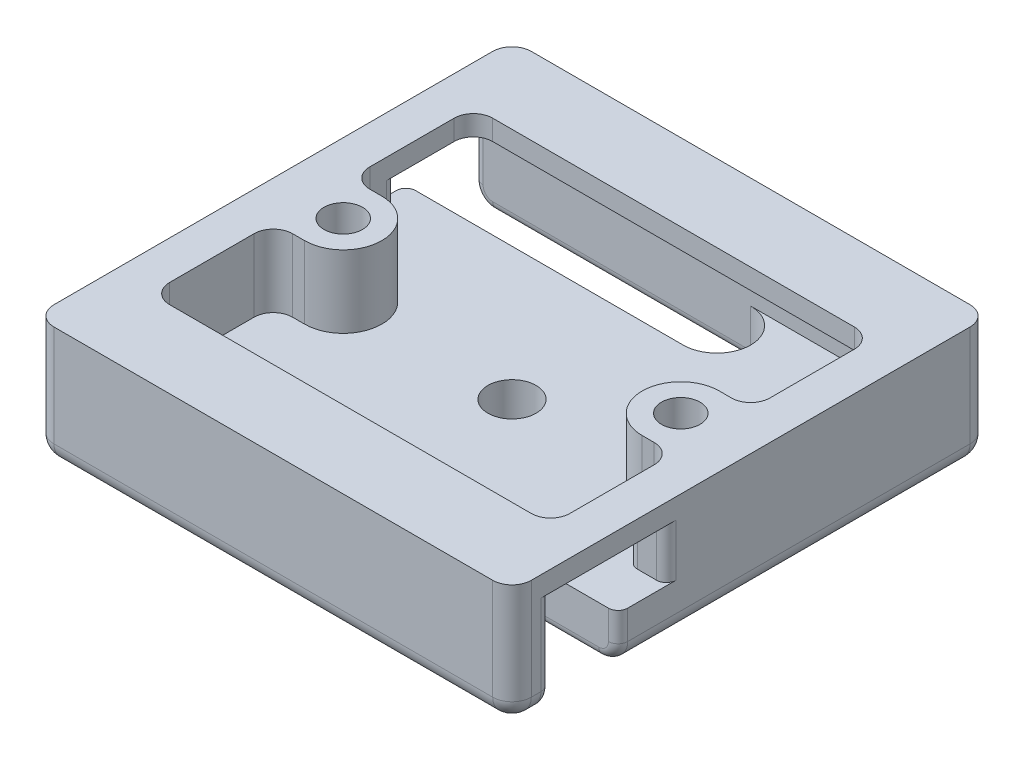
from build123d import *

# Parameters (mm, degrees)
CROQUIS1_R                   = 2.5
SALIENTE_EXTRUIR1_DEPTH      = 5
SALIENTE_EXTRUIR2_DEPTH      = 5.5
SALIENTE_EXTRUIR5_DEPTH      = 2
SALIENTE_EXTRUIR5_DEPTH_BACK = 0.1
CROQUIS2_W                   = 41.5
CROQUIS2_H                   = 8
CROQUIS2_H_2                 = 4
CROQUIS2_W_2                 = 4
CROQUIS3_R                   = 2
SALIENTE_EXTRUIR6_DEPTH      = 7.5
CORTAR_EXTRUIR1_REACH        = 39.167
CROQUIS3_3_R                 = 2
CORTAR_EXTRUIR2_START        = -3
CROQUIS4_R                   = 3.5
CROQUIS4_R_2                 = 2
CORTAR_EXTRUIR2_DEPTH        = 3
REDONDEO1_R                  = 2
REDONDEO4_R                  = 2
REDONDEO3_R                  = 1


with BuildPart() as part:
    # Croquis1 → Saliente-Extruir1 (new body)
    with BuildSketch(Plane(origin=(0, 0, 0), x_dir=(1, 0, 0), z_dir=(0, 1, 0))):
        with BuildLine():
            Line((-24.75, -24.75), (24.75, -24.75))
            Line((24.75, -24.75), (24.75, -20.75))
            Line((24.75, -20.75), (-4, -20.75))
            ThreePointArc((-4, -20.75), (-7.5, -17.25), (-4, -13.75))
            Line((-4, -13.75), (24.75, -13.75))
            Line((24.75, -13.75), (24.75, 24.75))
            Line((24.75, 24.75), (-24.75, 24.75))
            Line((-24.75, 24.75), (-24.75, 20.75))
            Line((-24.75, 20.75), (4, 20.75))
            ThreePointArc((4, 20.75), (7.5, 17.25), (4, 13.75))
            Line((4, 13.75), (-24.75, 13.75))
            Line((-24.75, 13.75), (-24.75, -24.75))
        make_face()
        with Locations(Location((0, 0, 0), (0, 0, 270))):
            Circle(CROQUIS1_R, mode=Mode.SUBTRACT)
    extrude(amount=-SALIENTE_EXTRUIR1_DEPTH)

    # Croquis1<3> → Saliente-Extruir2 (add)
    with BuildSketch(Plane(origin=(0, 0, 0), x_dir=(1, 0, 0), z_dir=(0, 1, 0))):
        Polygon((-24.75, 8.75), (-24.75, -24.75), (24.75, -24.75), (24.75, -20.75), (-4, -20.75), (-20.75, -20.75), (-20.75, 8.75), align=None)
        Polygon((-24.75, 24.75), (-24.75, 20.75), (4, 20.75), (20.75, 20.75), (20.75, -8.75), (24.75, -8.75), (24.75, 24.75), align=None)
    extrude(amount=SALIENTE_EXTRUIR2_DEPTH)

    # Croquis2 → Saliente-Extruir5 (add, two sides: drawn at the far end of the back side and taken through both)
    with BuildSketch(Plane(origin=(0, 5.5, 0), x_dir=(1, 0, 0), z_dir=(0, 1, 0)).offset(-SALIENTE_EXTRUIR5_DEPTH_BACK)):
        with Locations((0, 20.75)):
            Rectangle(CROQUIS2_W, CROQUIS2_H)
        Polygon((-20.75, 24.75), (-24.75, 24.75), (-24.75, 8.75), (-20.75, 8.75), (-20.75, 16.75), align=None)
        with Locations((0, -18.75)):
            Rectangle(CROQUIS2_W, CROQUIS2_H_2)
        with Locations((0, -22.75)):
            Rectangle(CROQUIS2_W, CROQUIS2_H_2)
        Polygon((-20.75, 8.75), (-24.75, 8.75), (-24.75, -24.75), (-20.75, -24.75), (-20.75, -20.75), (-20.75, -16.75), align=None)
        Polygon((24.75, 24.75), (20.75, 24.75), (20.75, 16.75), (20.75, -16.75), (20.75, -20.75), (24.75, -20.75), align=None)
        with Locations((22.75, -22.75)):
            Rectangle(CROQUIS2_W_2, CROQUIS2_H_2)
    extrude(amount=SALIENTE_EXTRUIR5_DEPTH + SALIENTE_EXTRUIR5_DEPTH_BACK)

    # Croquis3 → Saliente-Extruir6 (add)
    with BuildSketch(Plane(origin=(0, 7.5, 0), x_dir=(1, 0, 0), z_dir=(0, 1, 0))):
        with BuildLine():
            Line((-20.75, 4), (-20.75, -4))
            Line((-20.75, -4), (-17.5, -4))
            ThreePointArc((-17.5, -4), (-13.5, 0), (-17.5, 4))
            Line((-17.5, 4), (-20.75, 4))
        make_face()
        with Locations(Location((-17.5, 0, 0), (0, 0, 270))):
            Circle(CROQUIS3_R, mode=Mode.SUBTRACT)
    saliente_extruir6 = extrude(amount=-SALIENTE_EXTRUIR6_DEPTH)

    # Croquis3<3> → Cortar-Extruir1 (cut, up to next)
    with BuildSketch(Plane(origin=(0, 7.5, 0), x_dir=(1, 0, 0), z_dir=(0, 1, 0)), mode=Mode.PRIVATE) as cortar_extruir1_sk1:
        with Locations(Location((-17.5, 0, 0), (0, 0, 270))):
            Circle(CROQUIS3_3_R)
    cortar_extruir1_tool1 = extrude(cortar_extruir1_sk1.sketch, amount=-CORTAR_EXTRUIR1_REACH, mode=Mode.PRIVATE) & part.part
    cortar_extruir1 = cortar_extruir1_tool1.solids().sort_by_distance((-17.5, 7.5, 0))[0]
    add(cortar_extruir1, mode=Mode.SUBTRACT)

    # Simetría1: Saliente-Extruir6, Cortar-Extruir1 across plane
    add(saliente_extruir6.mirror(Plane(origin=(0, 0, 0), x_dir=(0, 0, 1), z_dir=(1, 0, 0))))
    add(cortar_extruir1.mirror(Plane(origin=(0, 0, 0), x_dir=(0, 0, 1), z_dir=(1, 0, 0))), mode=Mode.SUBTRACT)

    # Croquis4 → Cortar-Extruir2 (cut)
    # profile 1 of 2: a face of its own
    with BuildSketch(Plane.XZ.offset(5).offset(CORTAR_EXTRUIR2_START)):
        with Locations(Location((-17.5, 0, 0), (0, 0, 270))):
            Circle(CROQUIS4_R)
        with Locations(Location((-17.5, 0, 0), (0, 0, 90))):
            Circle(CROQUIS4_R_2, mode=Mode.SUBTRACT)
    # profile 2 of 2: a face of its own
    with BuildSketch(Plane.XZ.offset(5).offset(CORTAR_EXTRUIR2_START)):
        with Locations(Location((17.5, 0, 0), (0, 0, 270))):
            Circle(CROQUIS4_R)
        with Locations(Location((17.5, 0, 0), (0, 0, 90))):
            Circle(CROQUIS4_R_2, mode=Mode.SUBTRACT)
    extrude(amount=CORTAR_EXTRUIR2_DEPTH, mode=Mode.SUBTRACT)

    # Redondeo1
    redondeo1_edges = [part.edges().sort_by_distance(p)[0] for p in [
        (20.75, 6.45, 16.75),
        (-20.75, 6.45, 16.75),
        (20.75, 6.45, -16.75),
        (-20.75, 3.75, -4),
        (-20.75, 3.75, 4),
        (20.75, 3.75, 4),
        (20.75, 3.75, -4),
        (-20.75, 6.45, -16.75),
    ]]
    fillet(redondeo1_edges, radius=REDONDEO1_R)

    # Redondeo4
    redondeo4_edges = [part.edges().sort_by_distance(p)[0] for p in [
        (0, -5, -24.75),
        (-24.75, -5, -22.75),
        (24.75, 1.25, 24.75),
        (-24.75, 1.25, 24.75),
        (-24.75, 1.25, -24.75),
        (24.75, 1.25, -24.75),
        (-24.75, -5, 5.5),
        (0, -5, 24.75),
        (24.75, -5, 22.75),
        (24.75, -5, -5.5),
        (20.75, 2.7, -20.75),
        (-20.75, 2.7, 20.75),
    ]]
    fillet(redondeo4_edges, radius=REDONDEO4_R)

    # Redondeo3
    redondeo3_edges = [part.edges().sort_by_distance(p)[0] for p in [
        (7.5, -5, -17.25),
        (24.75, 1.2, 20.75),
        (24.75, -1.5, 13.75),
        (9.375, -5, 13.75),
        (9.375, -5, 20.75),
        (-9.375, -5, -13.75),
        (-9.375, -5, -20.75),
        (24.164213562, -4.414213562, 13.75),
        (24.164213562, -4.414213562, 20.75),
        (-24.75, -1.5, -13.75),
        (-24.164213562, -4.414213562, -13.75),
        (-24.75, 1.2, -20.75),
        (-24.164213562, -4.414213562, -20.75),
        (-7.5, -5, 17.25),
        (24.75, 2.7, 8.75),
        (20.75, 2.7, 8.75),
        (-24.75, 2.7, -8.75),
        (-20.75, 2.7, -8.75),
    ]]
    fillet(redondeo3_edges, radius=REDONDEO3_R)


solid = part.part
